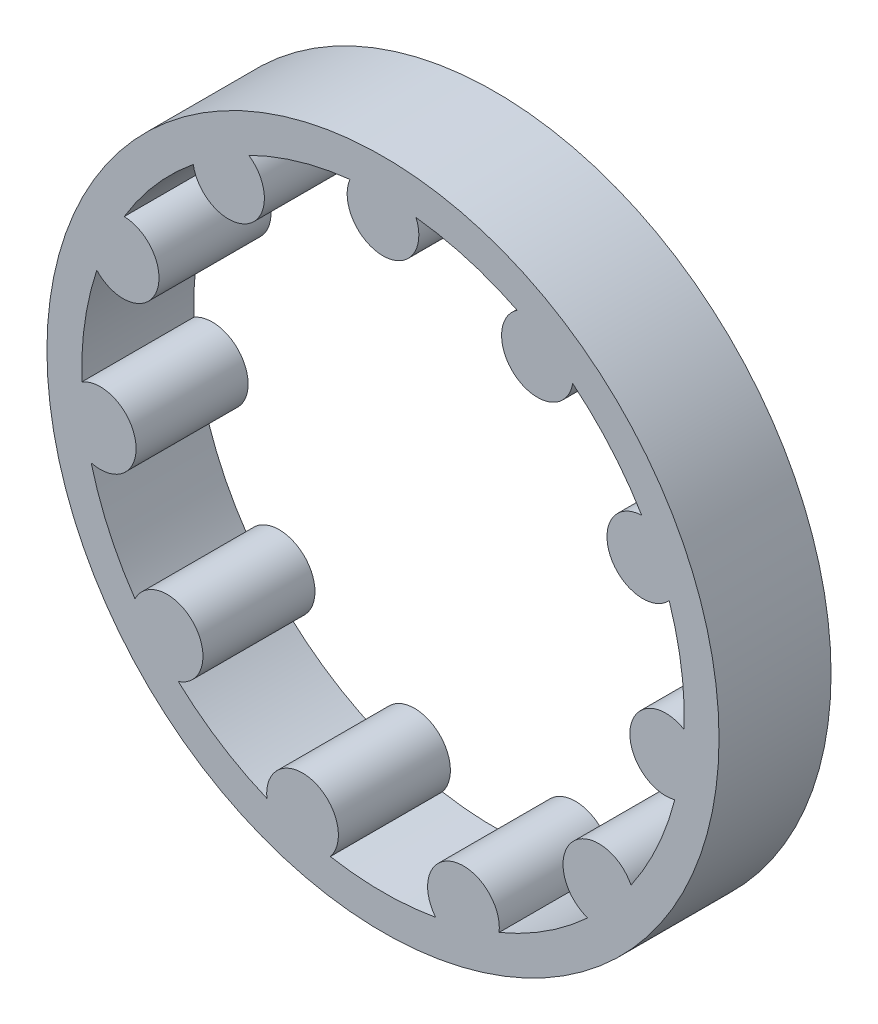
from build123d import *

# Parameters (mm, degrees)
SKETCH1_R           = 30
BOSS_EXTRUDE2_DEPTH = 10


with BuildPart() as part:
    # Sketch1 → Boss-Extrude2 (new body)
    with BuildSketch(Plane.XY):
        Circle(SKETCH1_R)
        with BuildLine():
            ThreePointArc((23.097766714, 13.791586472), (20.284793496, 9.26375479), (25.548806069, 8.424558923))
            ThreePointArc((25.548806069, 8.424558923), (26.628122722, 3.828546057), (26.887372433, -0.885374634))
            ThreePointArc((26.887372433, -0.885374634), (22.073018154, -3.173620893), (26.047683788, -6.725537442))
            ThreePointArc((26.047683788, -6.725537442), (24.470870582, -11.175472139), (22.140427382, -15.28123555))
            ThreePointArc((22.140427382, -15.28123555), (16.853215508, -14.603394367), (18.276605948, -19.740323189))
            ThreePointArc((18.276605948, -19.740323189), (14.544289936, -22.631356894), (10.364053074, -24.825412151))
            ThreePointArc((10.364053074, -24.825412151), (6.282636018, -21.396693312), (4.702834857, -26.487695802))
            ThreePointArc((4.702834857, -26.487695802), (0, -26.90194574), (-4.702834857, -26.487695802))
            ThreePointArc((-4.702834857, -26.487695802), (-6.282636018, -21.396693312), (-10.364053074, -24.825412151))
            ThreePointArc((-10.364053074, -24.825412151), (-14.544289936, -22.631356894), (-18.276605948, -19.740323189))
            ThreePointArc((-18.276605948, -19.740323189), (-16.853215508, -14.603394367), (-22.140427382, -15.28123555))
            ThreePointArc((-22.140427382, -15.28123555), (-24.470870582, -11.175472139), (-26.047683788, -6.725537442))
            ThreePointArc((-26.047683788, -6.725537442), (-22.073018154, -3.173620893), (-26.887372433, -0.885374634))
            ThreePointArc((-26.887372433, -0.885374634), (-26.628122722, 3.828546057), (-25.548806069, 8.424558923))
            ThreePointArc((-25.548806069, 8.424558923), (-20.284793496, 9.26375479), (-23.097766714, 13.791586472))
            ThreePointArc((-23.097766714, 13.791586472), (-20.331134042, 17.617027932), (-16.938362942, 20.899917355))
            ThreePointArc((-16.938362942, 20.899917355), (-12.056290229, 18.759953782), (-11.974783264, 24.089816321))
            ThreePointArc((-11.974783264, 24.089816321), (-7.579153957, 25.812227914), (-2.950109262, 26.739699698))
            ThreePointArc((-2.950109262, 26.739699698), (0, 22.3), (2.950109262, 26.739699698))
            ThreePointArc((2.950109262, 26.739699698), (7.579153957, 25.812227914), (11.974783264, 24.089816321))
            ThreePointArc((11.974783264, 24.089816321), (12.056290229, 18.759953782), (16.938362942, 20.899917355))
            ThreePointArc((16.938362942, 20.899917355), (20.331134042, 17.617027932), (23.097766714, 13.791586472))
        make_face(mode=Mode.SUBTRACT)
    extrude(amount=BOSS_EXTRUDE2_DEPTH)


solid = part.part
